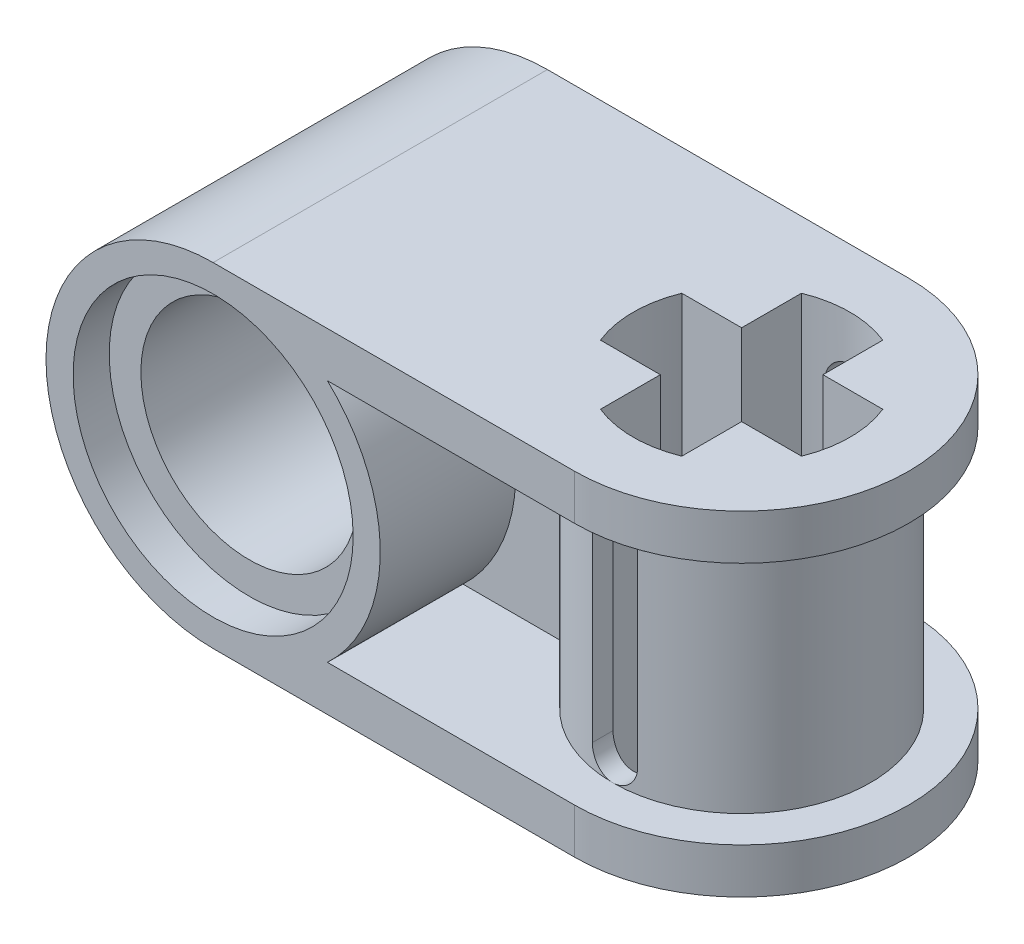
from build123d import *

# Parameters (mm, degrees)
SKETCH1_R            = 3.7
SKETCH1_R_2          = 2.4
PIN_SIDE_DEPTH       = 3.7
SIDE_START           = 3.7
SIDE_EAR_DEPTH       = 1
MIDDLE_RIB_DEPTH     = 0.7
SKETCH4_R            = 2.85
AXLE_BODY_DEPTH      = 3.7
AXLE_CUT_DEPTH       = 13.816785869
AXLE_CUT_DEPTH_BACK  = 13.816785869
SKETCH5_W            = 1.8
SKETCH5_H            = 1.8
AXLE_SLOT_DEPTH      = 13.816785869
AXLE_SLOT_DEPTH_BACK = 13.816785869
SKETCH7_R            = 3.1
PIN_RIM_DEPTH        = 0.8


with BuildPart() as part:
    # Sketch1 → Pin Side (new, symmetric)
    with BuildSketch(Plane.XY):
        Circle(SKETCH1_R)
        Circle(SKETCH1_R_2, mode=Mode.SUBTRACT)
    extrude(amount=PIN_SIDE_DEPTH, both=True)

    # Sketch2 → Side Ear (add)
    with BuildSketch(Plane(origin=(0, 0, 0), x_dir=(1, 0, 0), z_dir=(0, 1, 0)).offset(SIDE_START)):
        with BuildLine():
            Line((0, 3.7), (0, -3.7))
            Line((0, -3.7), (8, -3.7))
            ThreePointArc((8, -3.7), (11.7, 0), (8, 3.7))
            Line((8, 3.7), (0, 3.7))
        make_face()
    side_ear = extrude(amount=-SIDE_EAR_DEPTH)

    # Mirror1: Side Ear across plane
    add(side_ear.mirror(Plane.ZX))

    # Sketch3 → Middle Rib (add, symmetric)
    with BuildSketch(Plane.XY):
        with BuildLine():
            Line((2.529822128, -2.7), (8, -2.7))
            Line((8, -2.7), (8, 2.7))
            Line((8, 2.7), (2.529822128, 2.7))
            ThreePointArc((2.529822128, 2.7), (3.7, 0), (2.529822128, -2.7))
        make_face()
    extrude(amount=MIDDLE_RIB_DEPTH, both=True)

    # Sketch4 → Axle Body (add, symmetric)
    with BuildSketch(Plane(origin=(0, 0, 0), x_dir=(1, 0, 0), z_dir=(0, 1, 0))):
        with Locations((8, 0)):
            Circle(SKETCH4_R)
    extrude(amount=AXLE_BODY_DEPTH, both=True)

    # Sketch5 → Axle Cut (cut, two sides: drawn at the far end of the back side and taken through both)
    with BuildSketch(Plane(origin=(0, 0, 0), x_dir=(1, 0, 0), z_dir=(0, 1, 0)).offset(-AXLE_CUT_DEPTH_BACK)):
        with BuildLine():
            Line((5.775140454, -0.9), (7.1, -0.9))
            Line((7.1, -0.9), (7.1, 0.9))
            Line((7.1, 0.9), (5.775140454, 0.9))
            ThreePointArc((5.775140454, 0.9), (5.644191972, 0.458441422), (5.6, -1.6e-08))
            ThreePointArc((5.6, -1.6e-08), (5.644191976, -0.458441438), (5.775140454, -0.9))
        make_face()
        with BuildLine():
            Line((7.1, 0.9), (8.9, 0.9))
            Line((8.9, 0.9), (8.9, 2.224859546))
            ThreePointArc((8.9, 2.224859546), (8.45844143, 2.355808026), (8, 2.4))
            ThreePointArc((8, 2.4), (7.54155857, 2.355808026), (7.1, 2.224859546))
            Line((7.1, 2.224859546), (7.1, 0.9))
        make_face()
        with Locations((8, 0)):
            Rectangle(SKETCH5_W, SKETCH5_H)
        with BuildLine():
            Line((8.9, 0.9), (8.9, -0.9))
            Line((8.9, -0.9), (10.224859546, -0.9))
            ThreePointArc((10.224859546, -0.9), (10.355808026, -0.45844143), (10.4, 0))
            ThreePointArc((10.4, 0), (10.355808026, 0.45844143), (10.224859546, 0.9))
            Line((10.224859546, 0.9), (8.9, 0.9))
        make_face()
        with BuildLine():
            ThreePointArc((7.1, -2.224859546), (7.54155857, -2.355808026), (8, -2.4))
            ThreePointArc((8, -2.4), (8.45844143, -2.355808026), (8.9, -2.224859546))
            Line((8.9, -2.224859546), (8.9, -0.9))
            Line((8.9, -0.9), (7.1, -0.9))
            Line((7.1, -0.9), (7.1, -2.224859546))
        make_face()
    extrude(amount=AXLE_CUT_DEPTH + AXLE_CUT_DEPTH_BACK, mode=Mode.SUBTRACT)

    # Sketch6 → Axle Slot (cut, two sides: drawn at the far end of the back side and taken through both)
    with BuildSketch(Plane.XY.offset(-AXLE_SLOT_DEPTH_BACK)):
        with BuildLine():
            Line((7.5, -2.2), (7.5, 2.2))
            ThreePointArc((7.5, 2.2), (8, 2.7), (8.5, 2.2))
            Line((8.5, 2.2), (8.5, -2.2))
            ThreePointArc((8.5, -2.2), (8, -2.7), (7.5, -2.2))
        make_face()
    extrude(amount=AXLE_SLOT_DEPTH + AXLE_SLOT_DEPTH_BACK, mode=Mode.SUBTRACT)

    # Sketch7 → Pin Rim (cut)
    with BuildSketch(Plane.XY.offset(3.7)):
        Circle(SKETCH7_R)
    pin_rim = extrude(amount=-PIN_RIM_DEPTH, mode=Mode.SUBTRACT)

    # Mirror2: Pin Rim across plane
    add(pin_rim.mirror(Plane.XY), mode=Mode.SUBTRACT)


solid = part.part
